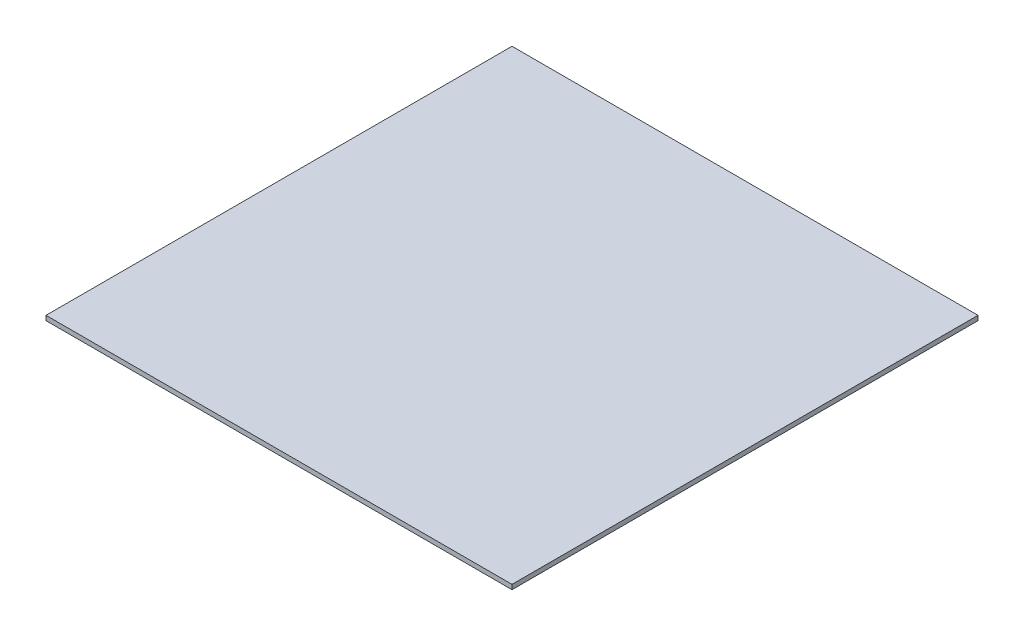
from build123d import *

# Parameters (mm, degrees)
SKETCH1_W           = 637.60096
SKETCH1_H           = 637.60096
BOSS_EXTRUDE1_DEPTH = 6.35


with BuildPart() as part:
    # Sketch1 → Boss-Extrude1 (new body)
    with BuildSketch(Plane(origin=(0, 0, 0), x_dir=(1, 0, 0), z_dir=(0, 1, 0))):
        with Locations((-318.80048, 318.80048)):
            Rectangle(SKETCH1_W, SKETCH1_H)
    extrude(amount=BOSS_EXTRUDE1_DEPTH)


solid = part.part
